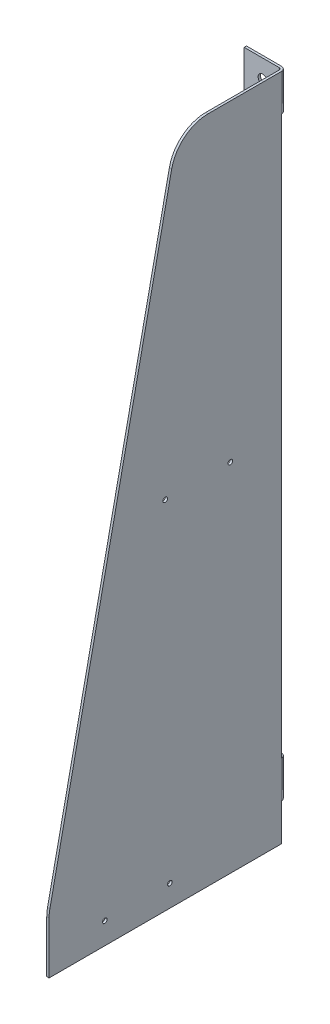
from build123d import *

# Parameters (mm, degrees)
BOSS_EXTRUDE2_DEPTH        = 3.175
SKETCH2_W                  = 3.175
SKETCH2_H                  = 50.8
BOSS_EXTRUDE3_DEPTH        = 50.8
FILLET3_R                  = 6.35
F_1_2_0_5_DIAMETER_HOLE1_D = 12.7
FILLET4_R                  = 3.175


with BuildPart() as part:
    # Sketch1 → Boss-Extrude2 (new body)
    with BuildSketch(Plane(origin=(0, 0, 0), x_dir=(0, 0, -1), z_dir=(1, 0, 0))):
        with BuildLine():
            Line((-317.5, 0), (0, 0))
            Line((0, 0), (0, 50.8))
            Line((0, 50.8), (6.35, 50.8))
            Line((6.35, 50.8), (6.35, 101.6))
            Line((6.35, 101.6), (0, 101.6))
            Line((0, 101.6), (0, 559.756235294))
            Line((0, 559.756235294), (0, 863.6))
            Line((0, 863.6), (6.35, 863.6))
            Line((6.35, 863.6), (6.35, 914.4))
            Line((6.35, 914.4), (-100.150182785, 914.4))
            ThreePointArc((-100.150182785, 914.4), (-132.16586597, 903.041552077), (-149.864680249, 874.045513001))
            Line((-149.864680249, 874.045513001), (-316.414497465, 81.366353538))
            ThreePointArc((-316.414497465, 81.366353538), (-317.227895618, 76.171722787), (-317.5, 70.920840537))
            Line((-317.5, 70.920840537), (-317.5, 0))
        make_face()
        with BuildLine():
            ThreePointArc((-244.475, 29.604131036), (-241.3, 32.779131036), (-238.125, 29.604131036))
            ThreePointArc((-238.125, 29.604131036), (-241.3, 26.429131036), (-244.475, 29.604131036))
        make_face(mode=Mode.SUBTRACT)
        with BuildLine():
            ThreePointArc((-149.225, 29.604131036), (-152.4, 26.429131036), (-155.575, 29.604131036))
            ThreePointArc((-155.575, 29.604131036), (-152.4, 32.779131036), (-149.225, 29.604131036))
        make_face(mode=Mode.SUBTRACT)
        with BuildLine():
            ThreePointArc((-161.925, 486.804131036), (-158.75, 489.979131036), (-155.575, 486.804131036))
            ThreePointArc((-155.575, 486.804131036), (-158.75, 483.629131036), (-161.925, 486.804131036))
        make_face(mode=Mode.SUBTRACT)
        with BuildLine():
            ThreePointArc((-66.675, 486.804131036), (-69.85, 483.629131036), (-73.025, 486.804131036))
            ThreePointArc((-73.025, 486.804131036), (-69.85, 489.979131036), (-66.675, 486.804131036))
        make_face(mode=Mode.SUBTRACT)
    extrude(amount=BOSS_EXTRUDE2_DEPTH)

    # Sketch2 → Boss-Extrude3 (add)
    with BuildSketch(Plane.ZY):
        with Locations((-4.7625, 889)):
            Rectangle(SKETCH2_W, SKETCH2_H)
        with Locations((-4.7625, 76.2)):
            Rectangle(SKETCH2_W, SKETCH2_H)
    extrude(amount=BOSS_EXTRUDE3_DEPTH)

    # Fillet3
    fillet3_edges = [part.edges().sort_by_distance(p)[0] for p in [
        (3.175, 76.2, -6.35),
        (3.175, 889, -6.35),
    ]]
    fillet(fillet3_edges, radius=FILLET3_R)

    # 1/2 (0.5) Diameter Hole1 (through all)
    with Locations(Plane.XY.offset(-3.175)):
        with Locations((-25.4, 76.2), (-25.4, 889)):
            Hole(F_1_2_0_5_DIAMETER_HOLE1_D / 2)

    # Fillet4
    fillet4_edges = [part.edges().sort_by_distance(p)[0] for p in [
        (0, 889, -3.175),
        (0, 76.2, -3.175),
    ]]
    fillet(fillet4_edges, radius=FILLET4_R)


solid = part.part
